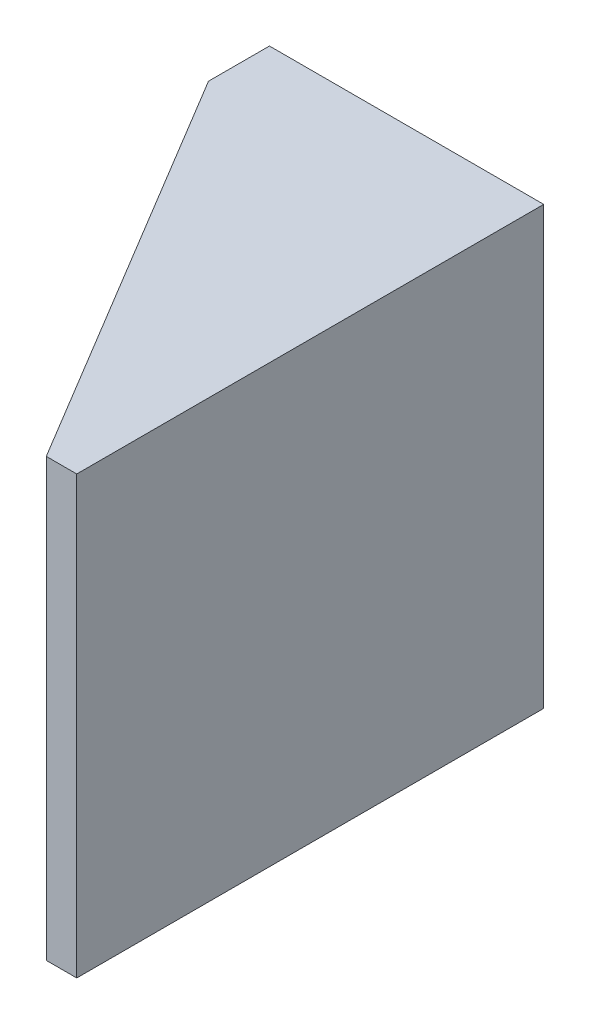
from build123d import *

# Parameters (mm, degrees)
BOSS_EXTRUDE1_DEPTH = 45.475
BOSS_EXTRUDE2_DEPTH = 3.175


with BuildPart() as part:
    # Sketch1 → Boss-Extrude1 (new body)
    with BuildSketch(Plane(origin=(0, 0, 0), x_dir=(1, 0, 0), z_dir=(0, 1, 0))):
        Polygon((0, 0), (0, -48.65), (-3.175, -48.65), (-3.175, -6.35), (-28.575, -6.35), (-28.575, 0), align=None)
    extrude(amount=BOSS_EXTRUDE1_DEPTH)

    # Sketch2 → Boss-Extrude2 (add)
    with BuildSketch(Plane(origin=(0, 45.475, 0), x_dir=(1, 0, 0), z_dir=(0, 1, 0))):
        Polygon((-28.575, -6.35), (-3.175, -48.65), (-3.175, -6.35), align=None)
    extrude(amount=-BOSS_EXTRUDE2_DEPTH)


solid = part.part
